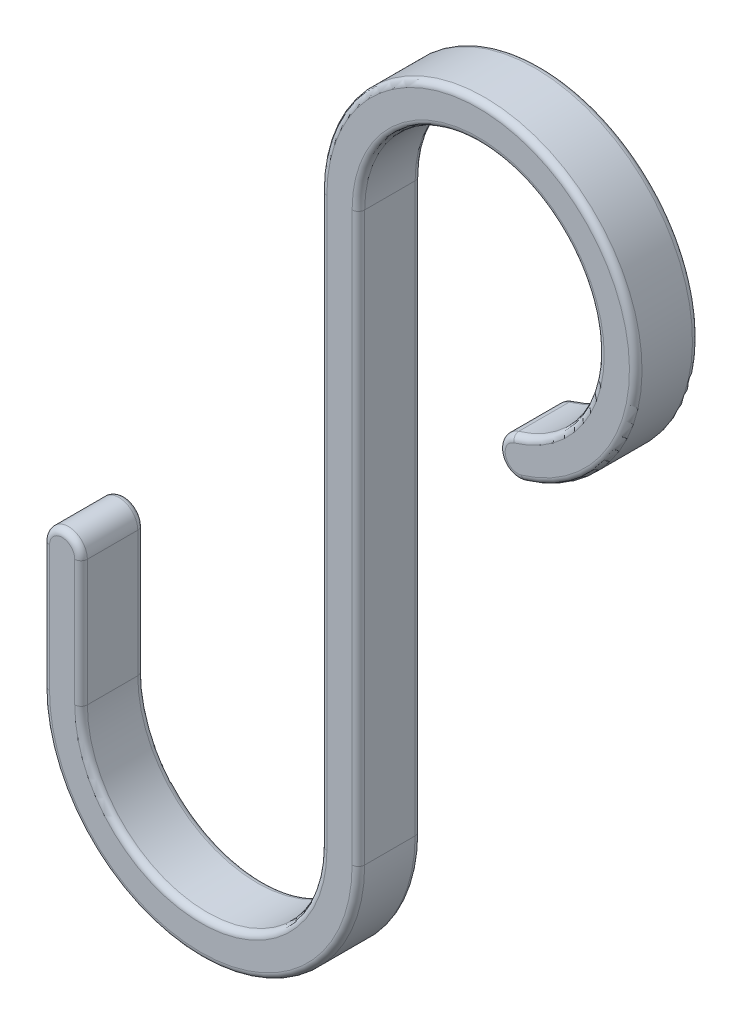
from build123d import *

# Parameters (mm, degrees)
BOSS_EXTRUDE1_DEPTH = 5
FILLET1_R           = 0.5
FILLET2_R           = 0.5


with BuildPart() as part:
    # Sketch1 → Boss-Extrude1 (new body)
    with BuildSketch(Plane.XY):
        with BuildLine():
            Line((-23.5, -22.5), (-23.5, -12.5))
            ThreePointArc((-23.5, -12.5), (-22, -11), (-20.5, -12.5))
            Line((-20.5, -12.5), (-20.5, -22.5))
            ThreePointArc((-20.5, -22.5), (-11, -32), (-1.5, -22.5))
            Line((-1.5, -22.5), (-1.5, 22.5))
            ThreePointArc((-1.5, 22.5), (18.470503063, 32.522054878), (14.570653438, 10.520833333))
            ThreePointArc((14.570653438, 10.520833333), (12.704675025, 11.529854921), (13.713696613, 13.395833333))
            ThreePointArc((13.713696613, 13.395833333), (16.677582328, 30.116761708), (1.5, 22.5))
            Line((1.5, 22.5), (1.5, -22.5))
            ThreePointArc((1.5, -22.5), (-11, -35), (-23.5, -22.5))
        make_face()
    extrude(amount=BOSS_EXTRUDE1_DEPTH)

    # Fillet1
    fillet1_edges = [part.edges().sort_by_distance(p)[0] for p in [
        (-22, -11, 5),
        (-20.5, -17.5, 5),
        (-11, -32, 5),
        (-1.5, 0, 5),
        (18.470503063, 32.522054878, 5),
        (12.704675025, 11.529854921, 5),
        (16.677582328, 30.116761708, 5),
        (1.5, 0, 5),
        (-11, -35, 5),
        (-23.5, -17.5, 5),
    ]]
    fillet(fillet1_edges, radius=FILLET1_R)

    # Fillet2
    fillet2_edges = [part.edges().sort_by_distance(p)[0] for p in [
        (12.704675025, 11.529854921, 0),
        (18.470503063, 32.522054878, 0),
        (-1.5, 0, 0),
        (-11, -32, 0),
        (-20.5, -17.5, 0),
        (-22, -11, 0),
        (-23.5, -17.5, 0),
        (-11, -35, 0),
        (1.5, 0, 0),
        (16.677582328, 30.116761708, 0),
    ]]
    fillet(fillet2_edges, radius=FILLET2_R)


solid = part.part
